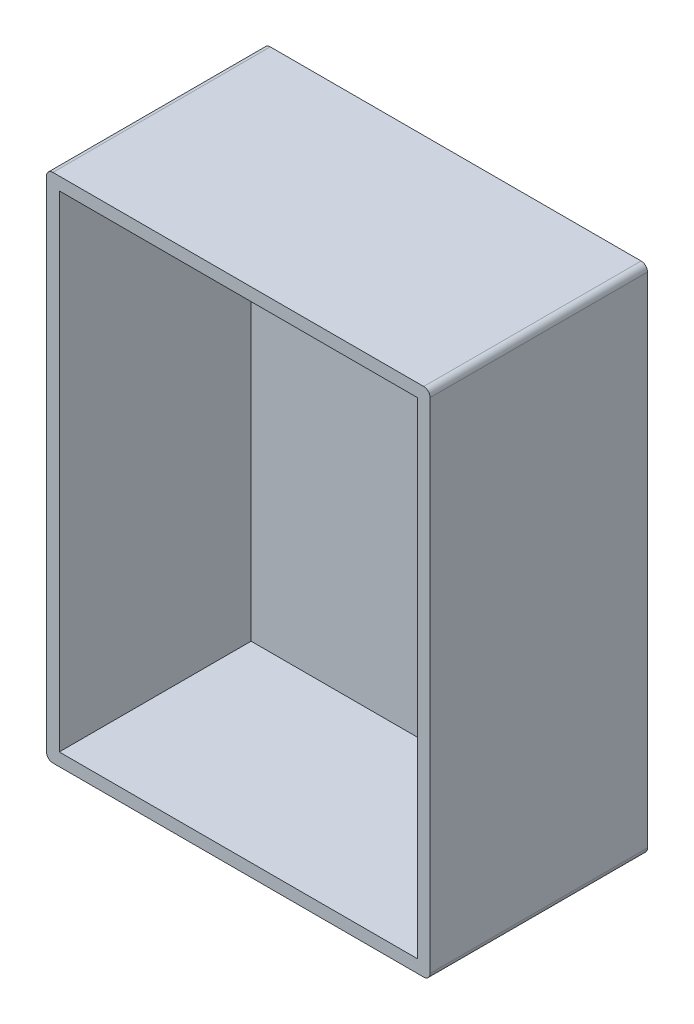
from build123d import *

# Parameters (mm, degrees)
SKETCH_1_W          = 300
SKETCH_1_H          = 400
EXTRUDE_1_DEPTH     = 170
SKETCH_2_W          = 280
SKETCH_2_H          = 380
CUT_EXTRUDE_1_DEPTH = 150
FILLET_1_R          = 5


with BuildPart() as part:
    # 草图1 → 凸台-拉伸1 (new body)
    with BuildSketch(Plane.XY):
        Rectangle(SKETCH_1_W, SKETCH_1_H)
    extrude(amount=EXTRUDE_1_DEPTH)

    # 草图2 → 切除-拉伸1 (cut)
    with BuildSketch(Plane.XY.offset(170)):
        Rectangle(SKETCH_2_W, SKETCH_2_H)
    extrude(amount=-CUT_EXTRUDE_1_DEPTH, mode=Mode.SUBTRACT)

    # 圆角1
    fillet_1_edges = [part.edges().sort_by_distance(p)[0] for p in [
        (150, -200, 85),
        (-150, -200, 85),
        (-150, 200, 85),
        (150, 200, 85),
    ]]
    fillet(fillet_1_edges, radius=FILLET_1_R)


solid = part.part
